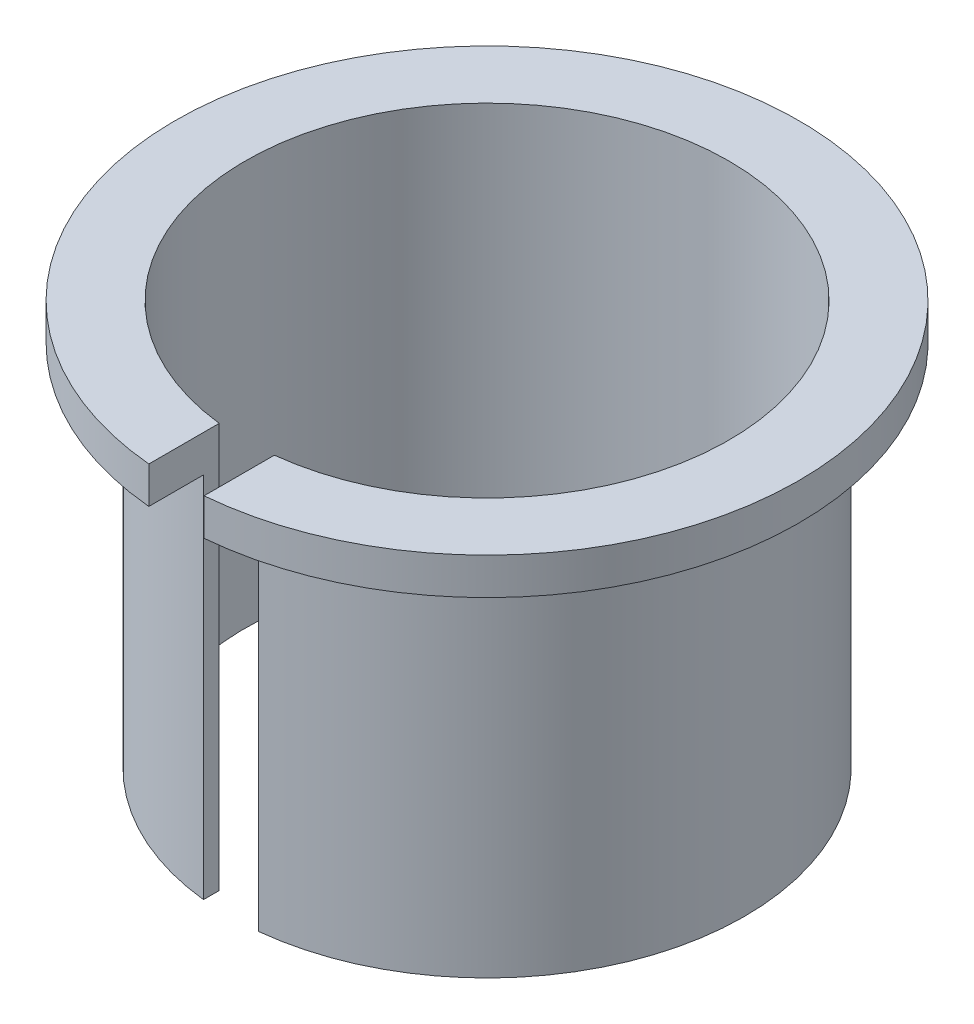
from build123d import *

# Parameters (mm, degrees)
BOSS_EXTRUDE1_DEPTH = 20
BOSS_EXTRUDE2_DEPTH = 2


with BuildPart() as part:
    # Sketch1 → Boss-Extrude1 (new body)
    with BuildSketch(Plane(origin=(0, 0, 0), x_dir=(1, 0, 0), z_dir=(0, 1, 0))):
        with BuildLine():
            Line((-1.5, -13.064168554), (-1.5, -13.919410907))
            ThreePointArc((-1.5, -13.919410907), (0, 14), (1.5, -13.919410907))
            Line((1.5, -13.919410907), (1.5, -13.064168554))
            ThreePointArc((1.5, -13.064168554), (0, 13.15), (-1.5, -13.064168554))
        make_face()
    extrude(amount=BOSS_EXTRUDE1_DEPTH)

    # Sketch2 → Boss-Extrude2 (add)
    with BuildSketch(Plane(origin=(0, 20, 0), x_dir=(1, 0, 0), z_dir=(0, 1, 0))):
        with BuildLine():
            Line((-1.5, -13.064168554), (-1.5, -16.888391582))
            ThreePointArc((-1.5, -16.888391582), (0, 16.954874527), (1.5, -16.888391582))
            Line((1.5, -16.888391582), (1.5, -13.064168554))
            ThreePointArc((1.5, -13.064168554), (0, 13.15), (-1.5, -13.064168554))
        make_face()
    extrude(amount=BOSS_EXTRUDE2_DEPTH)


solid = part.part
